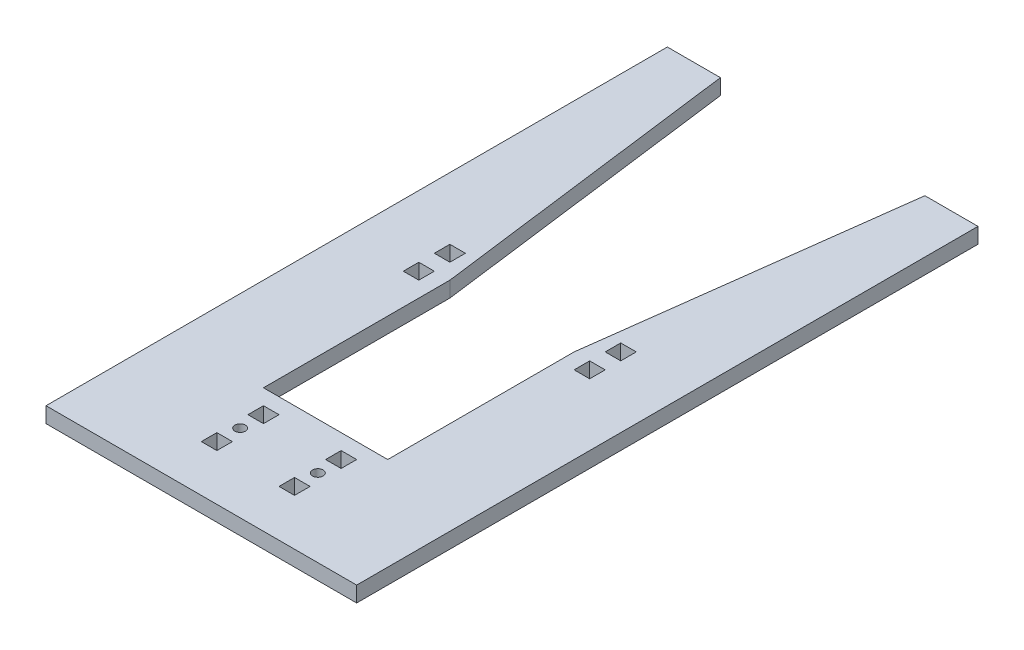
from build123d import *

# Parameters (mm, degrees)
BOTTOM_PLATE_R      = 2.159
BOTTOM_PLATE_R_2    = 2.794
BOTTOM_PLATE_W      = 25.4
BOTTOM_PLATE_H      = 101.6
BOTTOM_PLATE_W_2    = 6.35
BOTTOM_PLATE_H_2    = 6.35
BOSS_EXTRUDE1_DEPTH = 6.35
SKETCH1_W           = 508
SKETCH1_H           = 508
SKETCH1_W_2         = 127
SKETCH1_H_2         = 254
CUT_EXTRUDE2_DEPTH  = 25.4


with BuildPart() as part:
    # Bottom Plate → Boss-Extrude1 (new body)
    # profile 1 of 3: a face of its own
    with BuildSketch(Plane(origin=(0, 0, 0), x_dir=(1, 0, 0), z_dir=(0, 1, 0))):
        with BuildLine():
            Line((25.4, 0), (50.8, 196.747553987))
            ThreePointArc((50.8, 196.747553987), (0, -203.2), (-50.8, 196.747553987))
            Line((-50.8, 196.747553987), (-25.4, 0))
            Line((-25.4, 0), (-25.4, -76.2))
            Line((-25.4, -76.2), (25.4, -76.2))
            Line((25.4, -76.2), (25.4, 0))
        make_face()
        with Locations((155.026770144, 72.009)):
            Circle(BOTTOM_PLATE_R, mode=Mode.SUBTRACT)
        with Locations((155.026770144, -72.009)):
            Circle(BOTTOM_PLATE_R, mode=Mode.SUBTRACT)
        with Locations((57.243949466, 172.269543754)):
            Circle(BOTTOM_PLATE_R, mode=Mode.SUBTRACT)
        with Locations(Location((-15.875, -95.25, 0), (0, 0, 270))):
            Circle(BOTTOM_PLATE_R, mode=Mode.SUBTRACT)
        with Locations((27.813, -152.4)):
            Circle(BOTTOM_PLATE_R_2, mode=Mode.SUBTRACT)
        with Locations((-27.813, -152.4)):
            Circle(BOTTOM_PLATE_R_2, mode=Mode.SUBTRACT)
        with Locations(Location((15.875, -95.25, 0), (0, 0, 90))):
            Circle(BOTTOM_PLATE_R, mode=Mode.SUBTRACT)
        with Locations((-155.026770144, -72.009)):
            Circle(BOTTOM_PLATE_R, mode=Mode.SUBTRACT)
        with Locations((-155.026770144, 72.009)):
            Circle(BOTTOM_PLATE_R, mode=Mode.SUBTRACT)
        with Locations((-57.243949466, 172.269543754)):
            Circle(BOTTOM_PLATE_R, mode=Mode.SUBTRACT)
        with Locations((170.901770144, 0)):
            Rectangle(BOTTOM_PLATE_W, BOTTOM_PLATE_H, mode=Mode.SUBTRACT)
        with Locations((-34.925, 9.525)):
            Rectangle(BOTTOM_PLATE_W_2, BOTTOM_PLATE_H_2, mode=Mode.SUBTRACT)
        with Locations((34.925, -3.175)):
            Rectangle(BOTTOM_PLATE_W_2, BOTTOM_PLATE_H_2, mode=Mode.SUBTRACT)
        with Locations((34.925, 9.525)):
            Rectangle(BOTTOM_PLATE_W_2, BOTTOM_PLATE_H_2, mode=Mode.SUBTRACT)
        with Locations((155.026770144, -60.325)):
            Rectangle(BOTTOM_PLATE_W_2, BOTTOM_PLATE_H_2, mode=Mode.SUBTRACT)
        with Locations((155.026770144, 60.325)):
            Rectangle(BOTTOM_PLATE_W_2, BOTTOM_PLATE_H_2, mode=Mode.SUBTRACT)
        with Locations((-34.925, -3.175)):
            Rectangle(BOTTOM_PLATE_W_2, BOTTOM_PLATE_H_2, mode=Mode.SUBTRACT)
        with Locations((-15.875, -85.725)):
            Rectangle(BOTTOM_PLATE_W_2, BOTTOM_PLATE_H_2, mode=Mode.SUBTRACT)
        with Locations((-15.875, -104.775)):
            Rectangle(BOTTOM_PLATE_W_2, BOTTOM_PLATE_H_2, mode=Mode.SUBTRACT)
        with Locations((15.875, -104.775)):
            Rectangle(BOTTOM_PLATE_W_2, BOTTOM_PLATE_H_2, mode=Mode.SUBTRACT)
        with Locations((15.875, -85.725)):
            Rectangle(BOTTOM_PLATE_W_2, BOTTOM_PLATE_H_2, mode=Mode.SUBTRACT)
        with Locations((-170.901770144, 0)):
            Rectangle(BOTTOM_PLATE_W, BOTTOM_PLATE_H, mode=Mode.SUBTRACT)
        with Locations((-155.026770144, -60.325)):
            Rectangle(BOTTOM_PLATE_W_2, BOTTOM_PLATE_H_2, mode=Mode.SUBTRACT)
        with Locations((-155.026770144, 60.325)):
            Rectangle(BOTTOM_PLATE_W_2, BOTTOM_PLATE_H_2, mode=Mode.SUBTRACT)
    # profile 2 of 3: a face of its own
    with BuildSketch(Plane(origin=(0, 0, 0), x_dir=(1, 0, 0), z_dir=(0, 1, 0))):
        Polygon((55.672367921, 184.893668177), (61.970103658, 184.08063399), (62.783137846, 190.378369726), (56.485402109, 191.191403914), align=None)
    # profile 3 of 3: a face of its own
    with BuildSketch(Plane(origin=(0, 0, 0), x_dir=(1, 0, 0), z_dir=(0, 1, 0))):
        Polygon((-61.970103658, 184.08063399), (-62.783137846, 190.378369726), (-56.485402109, 191.191403914), (-55.672367921, 184.893668177), align=None)
    extrude(amount=-BOSS_EXTRUDE1_DEPTH)

    # Sketch1 → Cut-Extrude2 (cut)
    with BuildSketch(Plane(origin=(0, 0, 0), x_dir=(1, 0, 0), z_dir=(0, 1, 0))):
        Rectangle(SKETCH1_W, SKETCH1_H)
        Rectangle(SKETCH1_W_2, SKETCH1_H_2, mode=Mode.SUBTRACT)
    extrude(amount=-CUT_EXTRUDE2_DEPTH, mode=Mode.SUBTRACT)


solid = part.part
